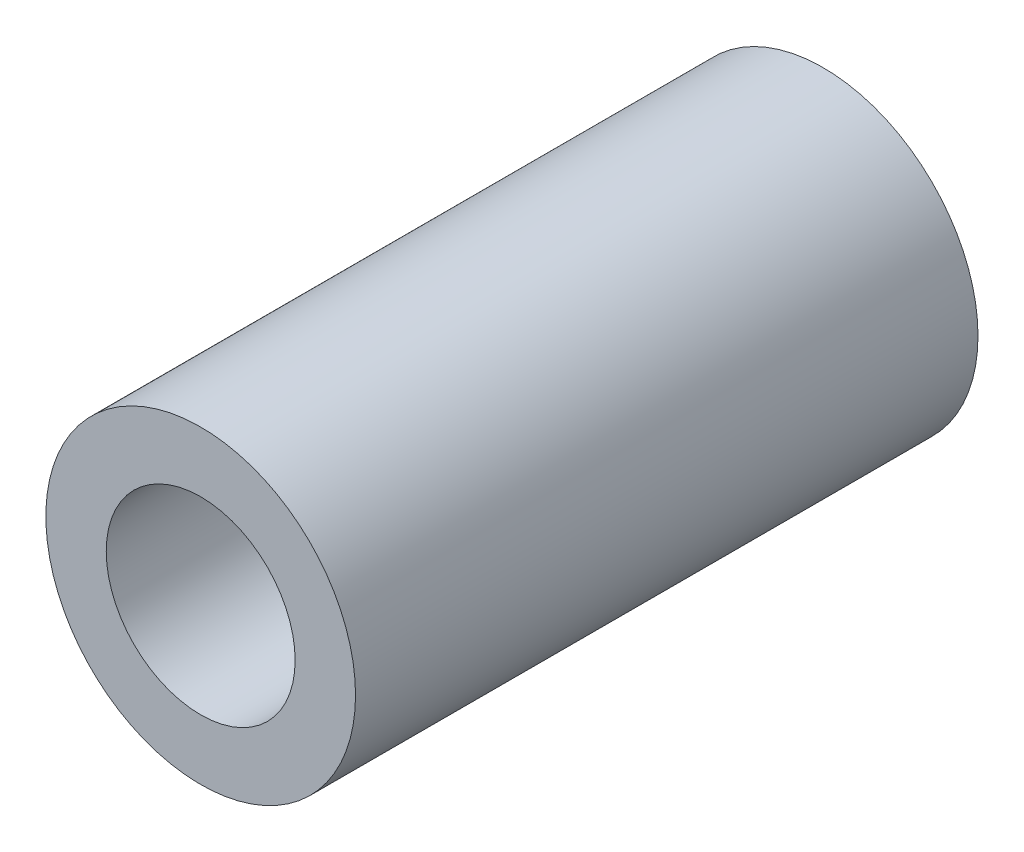
from build123d import *

# Parameters (mm, degrees)
SKETCH1_R           = 10
SKETCH1_R_2         = 6.1
BOSS_EXTRUDE1_DEPTH = 20.1


with BuildPart() as part:
    # Sketch1 → Boss-Extrude1 (new, symmetric)
    with BuildSketch(Plane.XY):
        Circle(SKETCH1_R)
        Circle(SKETCH1_R_2, mode=Mode.SUBTRACT)
    extrude(amount=BOSS_EXTRUDE1_DEPTH, both=True)


solid = part.part
